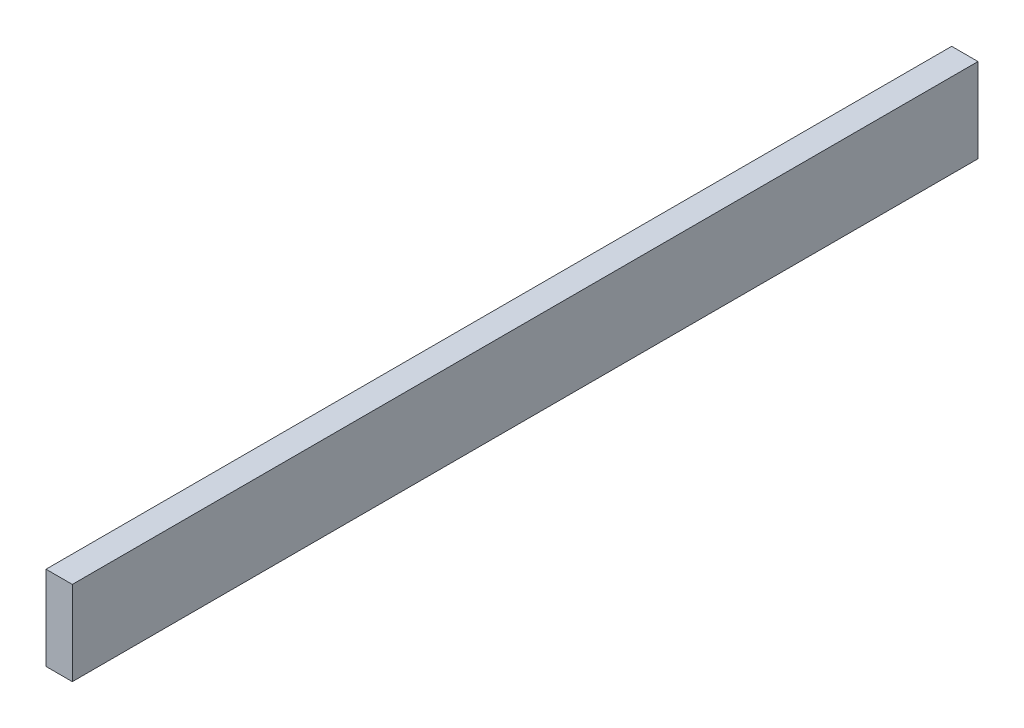
from build123d import *

# Parameters (mm, degrees)
CROQUIS_FALDON_W   = 25
CROQUIS_FALDON_H   = 860
FALDON_CORTO_DEPTH = 80


with BuildPart() as part:
    # Croquis_faldon → Faldon_corto (new body)
    with BuildSketch(Plane(origin=(0, 0, 0), x_dir=(1, 0, 0), z_dir=(0, 1, 0))):
        Rectangle(CROQUIS_FALDON_W, CROQUIS_FALDON_H)
    extrude(amount=FALDON_CORTO_DEPTH)


solid = part.part
